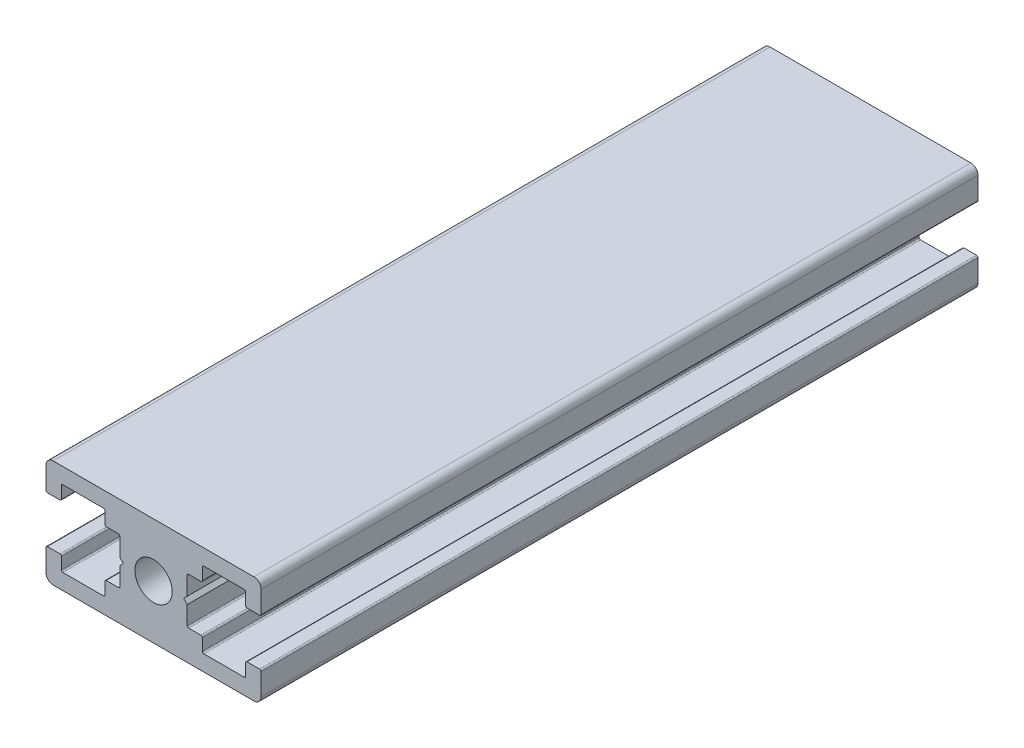
from build123d import *

# Parameters (mm, degrees)
SKETCH_1_R      = 2.6
EXTRUDE_1_DEPTH = 100


with BuildPart() as part:
    # 草图1 → 凸台-拉伸1 (new body)
    with BuildSketch(Plane.XY):
        with BuildLine():
            Line((-4.7, 0.5), (-4.2, 0))
            Line((-4.2, 0), (-4.7, -0.5))
            Line((-4.7, -0.5), (-4.7, -3.05))
            ThreePointArc((-4.7, -3.05), (-4.758578644, -3.191421356), (-4.9, -3.25))
            Line((-4.9, -3.25), (-6.6, -3.25))
            ThreePointArc((-6.6, -3.25), (-6.741421356, -3.308578644), (-6.8, -3.45))
            Line((-6.8, -3.45), (-6.8, -5.1))
            ThreePointArc((-6.8, -5.1), (-6.858578644, -5.241421356), (-7, -5.3))
            Line((-7, -5.3), (-12.65, -5.3))
            ThreePointArc((-12.65, -5.3), (-12.791421356, -5.241421356), (-12.85, -5.1))
            Line((-12.85, -5.1), (-12.85, -3.45))
            ThreePointArc((-12.85, -3.45), (-12.908578644, -3.308578644), (-13.05, -3.25))
            Line((-13.05, -3.25), (-14.8, -3.25))
            ThreePointArc((-14.8, -3.25), (-14.941421356, -3.308578644), (-15, -3.45))
            Line((-15, -3.45), (-15, -6.5))
            ThreePointArc((-15, -6.5), (-14.707106781, -7.207106781), (-14, -7.5))
            Line((-14, -7.5), (14, -7.5))
            ThreePointArc((14, -7.5), (14.707106781, -7.207106781), (15, -6.5))
            Line((15, -6.5), (15, -3.45))
            ThreePointArc((15, -3.45), (14.941421356, -3.308578644), (14.8, -3.25))
            Line((14.8, -3.25), (13.05, -3.25))
            ThreePointArc((13.05, -3.25), (12.908578644, -3.308578644), (12.85, -3.45))
            Line((12.85, -3.45), (12.85, -5.1))
            ThreePointArc((12.85, -5.1), (12.791421356, -5.241421356), (12.65, -5.3))
            Line((12.65, -5.3), (7, -5.3))
            ThreePointArc((7, -5.3), (6.858578644, -5.241421356), (6.8, -5.1))
            Line((6.8, -5.1), (6.8, -3.45))
            ThreePointArc((6.8, -3.45), (6.741421356, -3.308578644), (6.6, -3.25))
            Line((6.6, -3.25), (4.9, -3.25))
            ThreePointArc((4.9, -3.25), (4.758578644, -3.191421356), (4.7, -3.05))
            Line((4.7, -3.05), (4.7, -0.5))
            Line((4.7, -0.5), (4.2, 0))
            Line((4.2, 0), (4.7, 0.5))
            Line((4.7, 0.5), (4.7, 3.05))
            ThreePointArc((4.7, 3.05), (4.758578644, 3.191421356), (4.9, 3.25))
            Line((4.9, 3.25), (6.6, 3.25))
            ThreePointArc((6.6, 3.25), (6.741421356, 3.308578644), (6.8, 3.45))
            Line((6.8, 3.45), (6.8, 5.1))
            ThreePointArc((6.8, 5.1), (6.858578644, 5.241421356), (7, 5.3))
            Line((7, 5.3), (12.65, 5.3))
            ThreePointArc((12.65, 5.3), (12.791421356, 5.241421356), (12.85, 5.1))
            Line((12.85, 5.1), (12.85, 3.45))
            ThreePointArc((12.85, 3.45), (12.908578644, 3.308578644), (13.05, 3.25))
            Line((13.05, 3.25), (14.8, 3.25))
            ThreePointArc((14.8, 3.25), (14.941421356, 3.308578644), (15, 3.45))
            Line((15, 3.45), (15, 6.5))
            ThreePointArc((15, 6.5), (14.707106781, 7.207106781), (14, 7.5))
            Line((14, 7.5), (-14, 7.5))
            ThreePointArc((-14, 7.5), (-14.707106781, 7.207106781), (-15, 6.5))
            Line((-15, 6.5), (-15, 3.45))
            ThreePointArc((-15, 3.45), (-14.941421356, 3.308578644), (-14.8, 3.25))
            Line((-14.8, 3.25), (-13.05, 3.25))
            ThreePointArc((-13.05, 3.25), (-12.908578644, 3.308578644), (-12.85, 3.45))
            Line((-12.85, 3.45), (-12.85, 5.1))
            ThreePointArc((-12.85, 5.1), (-12.791421356, 5.241421356), (-12.65, 5.3))
            Line((-12.65, 5.3), (-7, 5.3))
            ThreePointArc((-7, 5.3), (-6.858578644, 5.241421356), (-6.8, 5.1))
            Line((-6.8, 5.1), (-6.8, 3.45))
            ThreePointArc((-6.8, 3.45), (-6.741421356, 3.308578644), (-6.6, 3.25))
            Line((-6.6, 3.25), (-4.9, 3.25))
            ThreePointArc((-4.9, 3.25), (-4.758578644, 3.191421356), (-4.7, 3.05))
            Line((-4.7, 3.05), (-4.7, 0.5))
        make_face()
        Circle(SKETCH_1_R, mode=Mode.SUBTRACT)
    extrude(amount=EXTRUDE_1_DEPTH)


solid = part.part
